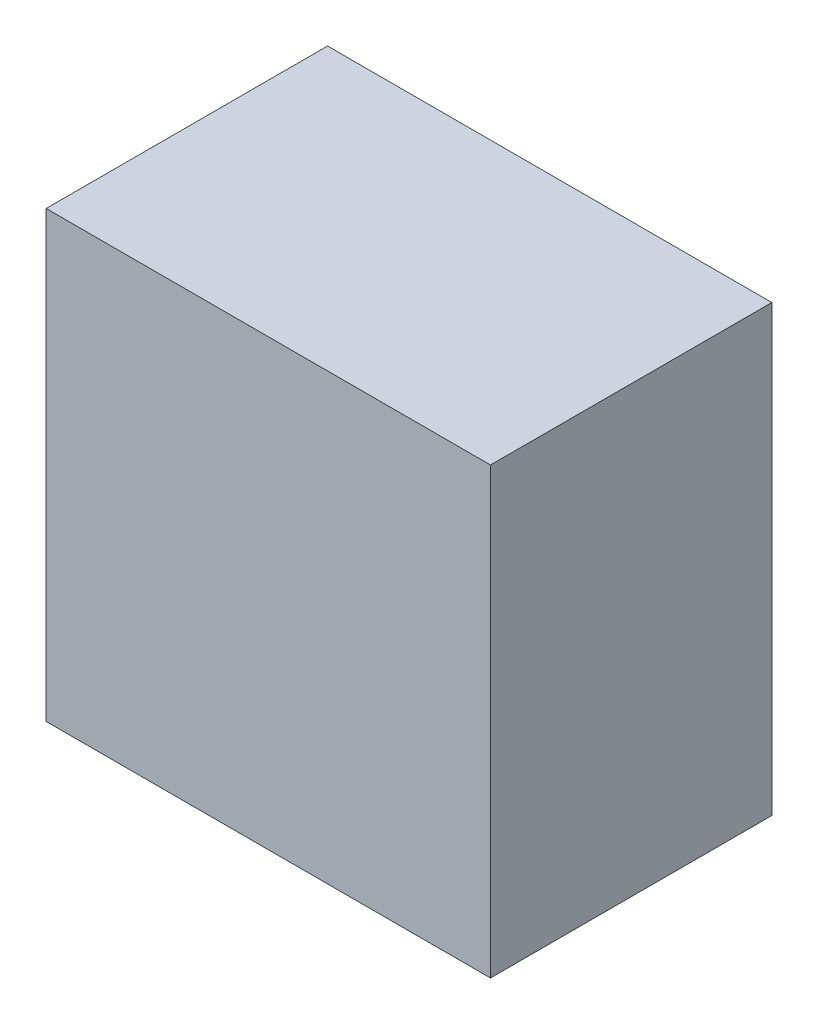
from build123d import *

# Parameters (mm, degrees)
SKETCH1_W           = 60
SKETCH1_H           = 60
BOSS_EXTRUDE1_DEPTH = 38


with BuildPart() as part:
    # Sketch1 → Boss-Extrude1 (new body)
    with BuildSketch(Plane.XY):
        Rectangle(SKETCH1_W, SKETCH1_H)
    extrude(amount=BOSS_EXTRUDE1_DEPTH)


solid = part.part
